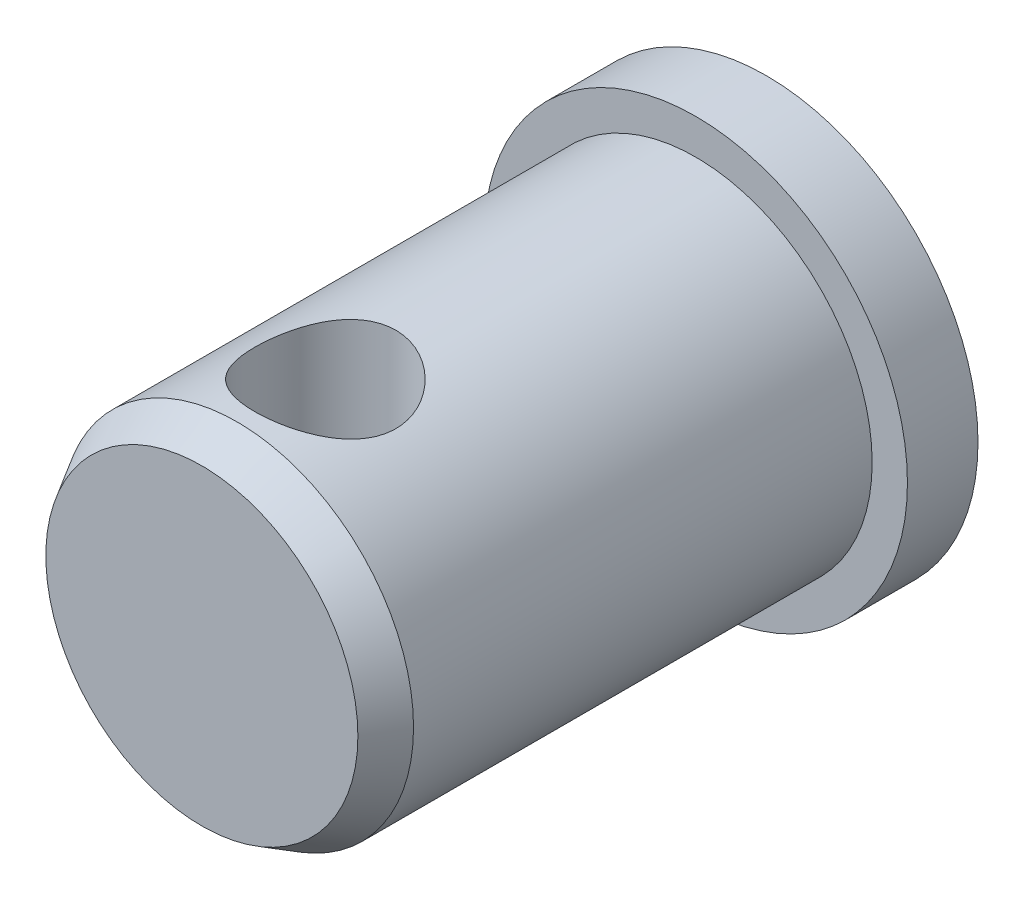
from build123d import *

# Parameters (mm, degrees)
SKETCH_1_R               = 3
EXTRUDE_1_DEPTH          = 1
SKETCH_1_3_R             = 2.5
EXTRUDE_2_DEPTH          = 8
CHAMFER_1_SIZE           = 0.5
CHAMFER_1_SIZE2          = 0.288675135
CUT_EXTRUDE_1_DEPTH      = 10.055385138
CUT_EXTRUDE_1_DEPTH_BACK = 10.055385138
SKETCH_2_R               = 1


with BuildPart() as part:
    # 草圖1 → 填料-伸長1 (new body)
    with BuildSketch(Plane.XY):
        Circle(SKETCH_1_R)
    extrude(amount=EXTRUDE_1_DEPTH)

    # 草圖1<3> → 填料-伸長2 (add)
    with BuildSketch(Plane.XY):
        Circle(SKETCH_1_3_R)
    extrude(amount=EXTRUDE_2_DEPTH)

    # 導角1
    chamfer_1_edges = [part.edges().sort_by_distance(p)[0] for p in [
        (-2.5, 0, 8),
    ]]
    chamfer_1_side = [part.faces().sort_by_distance(p)[0] for p in [
        (-2.5, 0, 4.5),
    ]]
    chamfer(chamfer_1_edges, length=CHAMFER_1_SIZE, length2=CHAMFER_1_SIZE2, reference=chamfer_1_side[0])

    # 草圖2 → 除料-伸長1 (cut, two sides: drawn at the far end of the back side and taken through both)
    with BuildSketch(Plane(origin=(0, 0, 0), x_dir=(1, 0, 0), z_dir=(0, 1, 0)).offset(-CUT_EXTRUDE_1_DEPTH_BACK)):
        with Locations((0, -6.25)):
            Circle(SKETCH_2_R)
    extrude(amount=CUT_EXTRUDE_1_DEPTH + CUT_EXTRUDE_1_DEPTH_BACK, mode=Mode.SUBTRACT)


solid = part.part
